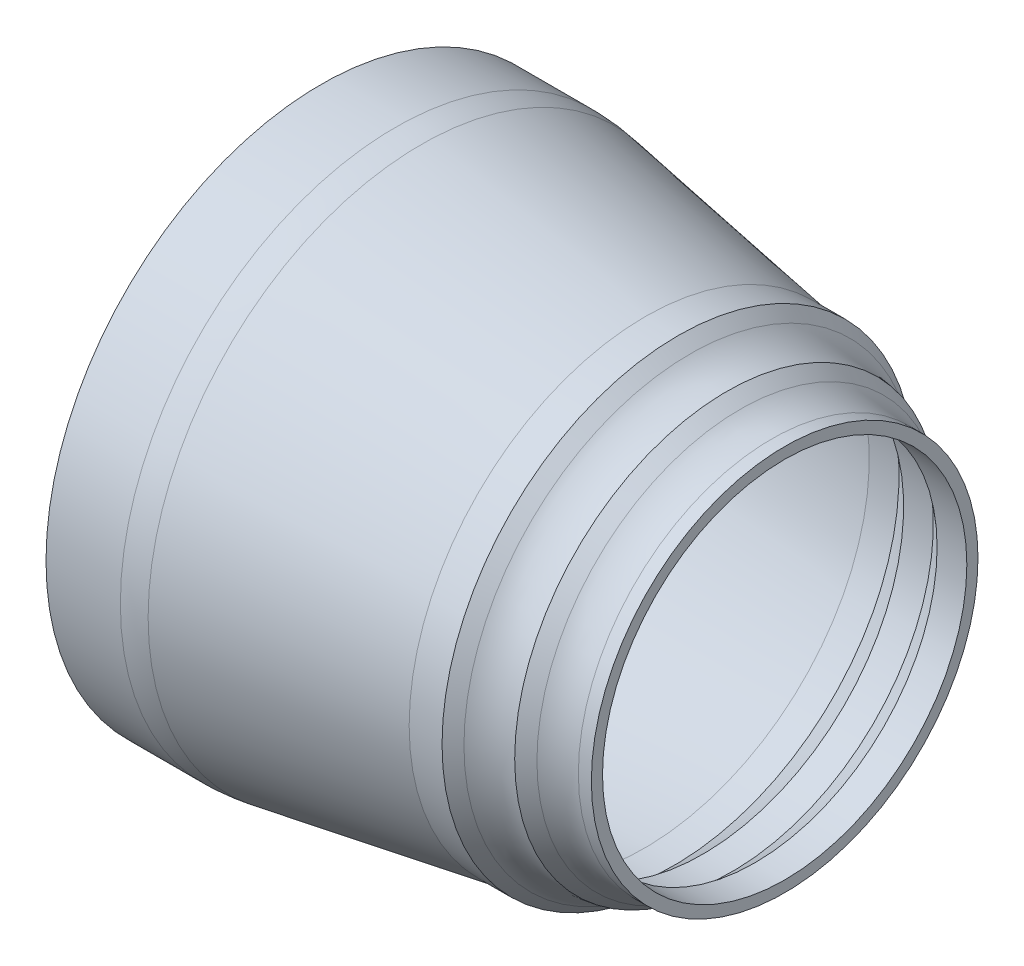
from build123d import *


with BuildPart() as part:
    # Sketch3 → Revolve3 (revolve)
    with BuildSketch(Plane.XY, mode=Mode.PRIVATE) as revolve3_sk:
        with BuildLine():
            Line((-206, -98), (-190, -98))
            Line((-190, -98), (-190, -104))
            Line((-190, -104), (-197, -104))
            ThreePointArc((-197, -104), (-205.900774526, -105.350807815), (-214, -109.281585811))
            Line((-214, -109.281585811), (-221.085945401, -114.154919145))
            ThreePointArc((-221.085945401, -114.154919145), (-231.635573734, -116.203059338), (-240.912230418, -121.628294541))
            Line((-240.912230418, -121.628294541), (-247.316956158, -127))
            Line((-247.316956158, -127), (-265.007764466, -127))
            Line((-265.007764466, -127), (-385.522110558, -146.907802754))
            ThreePointArc((-385.522110558, -146.907802754), (-392.425145491, -147.745592099), (-399.374599409, -147.988228651))
            Line((-399.374599409, -147.988228651), (-439.374599409, -147.988228651))
            Line((-439.374599409, -147.988228651), (-438.509351825, -145.325270406))
            add(Edge.make_bspline(
                [(-438.509351825, -145.325270406), (-438.092908159, -144.043588589), (-435.74371961, -142.389326154), (-433.583616452, -141.988422425), (-432.826378566, -141.988422425)],
                knots=[0, 0, 0, 0, 0.670786836, 1, 1, 1, 1], degree=3))
            Line((-432.826378566, -141.988422425), (-399.326378566, -141.988422425))
            ThreePointArc((-399.326378566, -141.988422425), (-392.891699012, -141.763758951), (-386.5, -140.988028076))
            Line((-386.5, -140.988028076), (-265.5, -121))
            Line((-265.5, -121), (-249.5, -121))
            Line((-249.5, -121), (-234, -108))
            Line((-234, -108), (-218, -108))
            Line((-218, -108), (-206, -98))
        make_face()
    revolve(revolve3_sk.sketch.rotate(Axis((0, 0, 0), (1, 0, 0)), 270), axis=Axis((0, 0, 0), (1, 0, 0)))


solid = part.part
